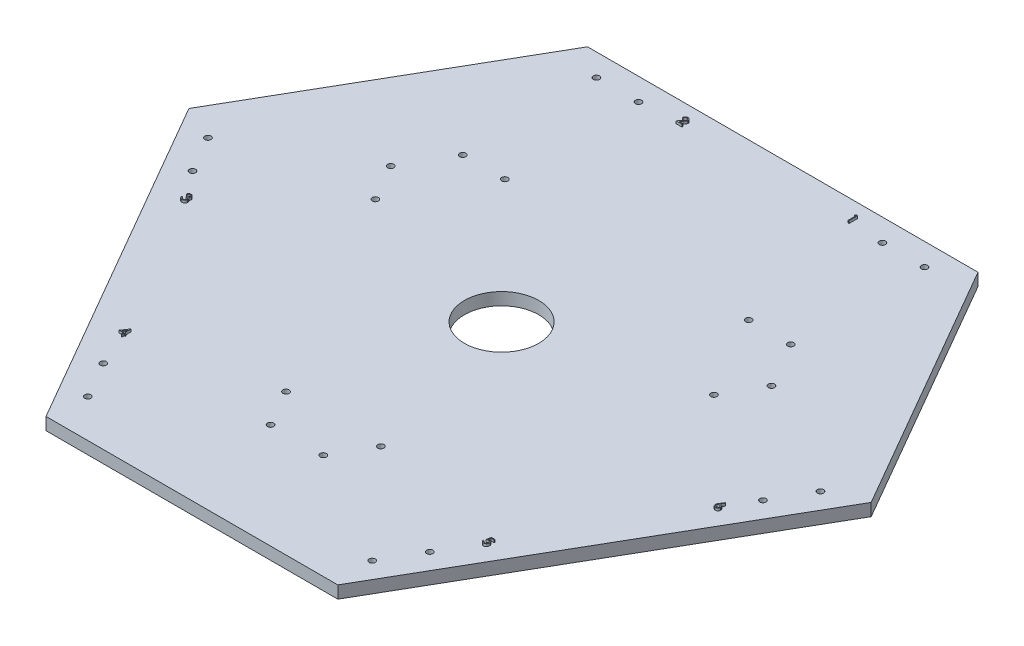
from build123d import *

# Parameters (mm, degrees)
SKETCH1_R           = 1.25
SKETCH1_R_2         = 15
BOSS_EXTRUDE1_DEPTH = 5
BOSS_EXTRUDE2_DEPTH = 1


with BuildPart() as part:
    # Sketch1 → Boss-Extrude1 (new body)
    with BuildSketch(Plane(origin=(0, 0, 0), x_dir=(1, 0, 0), z_dir=(0, 1, 0))):
        Polygon((-78.804643176, 113.506354147), (78.804643176, 113.506354147), (137.70170777, 11.493645853), (58.897064595, -125), (-58.897064595, -125), (-137.70170777, 11.493645853), align=None)
        with Locations(Location((-66.218576654, 104.506354147, 0), (0, 0, 270))):
            Circle(SKETCH1_R, mode=Mode.SUBTRACT)
        with Locations(Location((-49.218576654, 104.506354147, 0), (0, 0, 270))):
            Circle(SKETCH1_R, mode=Mode.SUBTRACT)
        with Locations(Location((-49.218576654, 50.506354147, 0), (0, 0, 270))):
            Circle(SKETCH1_R, mode=Mode.SUBTRACT)
        with Locations(Location((-66.218576654, 50.506354147, 0), (0, 0, 270))):
            Circle(SKETCH1_R, mode=Mode.SUBTRACT)
        with Locations(Location((66.218576654, 50.506354147, 0), (0, 0, 90))):
            Circle(SKETCH1_R, mode=Mode.SUBTRACT)
        with Locations(Location((49.218576654, 50.506354147, 0), (0, 0, 90))):
            Circle(SKETCH1_R, mode=Mode.SUBTRACT)
        with Locations(Location((49.218576654, 104.506354147, 0), (0, 0, 90))):
            Circle(SKETCH1_R, mode=Mode.SUBTRACT)
        with Locations(Location((66.218576654, 104.506354147, 0), (0, 0, 90))):
            Circle(SKETCH1_R, mode=Mode.SUBTRACT)
        with Locations(Location((123.614445876, 5.093792512, 0), (0, 0, 270))):
            Circle(SKETCH1_R, mode=Mode.SUBTRACT)
        with Locations(Location((115.114445876, -9.628639353, 0), (0, 0, 270))):
            Circle(SKETCH1_R, mode=Mode.SUBTRACT)
        with Locations(Location((68.349074071, 17.371360647, 0), (0, 0, 270))):
            Circle(SKETCH1_R, mode=Mode.SUBTRACT)
        with Locations(Location((76.849074071, 32.093792512, 0), (0, 0, 270))):
            Circle(SKETCH1_R, mode=Mode.SUBTRACT)
        with Locations(Location((10.630497417, -82.600146659, 0), (0, 0, 90))):
            Circle(SKETCH1_R, mode=Mode.SUBTRACT)
        with Locations(Location((19.130497417, -67.877714794, 0), (0, 0, 90))):
            Circle(SKETCH1_R, mode=Mode.SUBTRACT)
        with Locations(Location((65.895869221, -94.877714794, 0), (0, 0, 90))):
            Circle(SKETCH1_R, mode=Mode.SUBTRACT)
        with Locations(Location((57.395869221, -109.600146659, 0), (0, 0, 90))):
            Circle(SKETCH1_R, mode=Mode.SUBTRACT)
        with Locations(Location((-57.395869221, -109.600146659, 0), (0, 0, 270))):
            Circle(SKETCH1_R, mode=Mode.SUBTRACT)
        with Locations(Location((-65.895869221, -94.877714794, 0), (0, 0, 270))):
            Circle(SKETCH1_R, mode=Mode.SUBTRACT)
        with Locations(Location((-19.130497417, -67.877714794, 0), (0, 0, 270))):
            Circle(SKETCH1_R, mode=Mode.SUBTRACT)
        with Locations(Location((-10.630497417, -82.600146659, 0), (0, 0, 270))):
            Circle(SKETCH1_R, mode=Mode.SUBTRACT)
        with Locations(Location((-76.849074071, 32.093792512, 0), (0, 0, 90))):
            Circle(SKETCH1_R, mode=Mode.SUBTRACT)
        with Locations(Location((-68.349074071, 17.371360647, 0), (0, 0, 90))):
            Circle(SKETCH1_R, mode=Mode.SUBTRACT)
        with Locations(Location((-115.114445876, -9.628639353, 0), (0, 0, 90))):
            Circle(SKETCH1_R, mode=Mode.SUBTRACT)
        with Locations(Location((-123.614445876, 5.093792512, 0), (0, 0, 90))):
            Circle(SKETCH1_R, mode=Mode.SUBTRACT)
        with Locations(Location((0, 0, 0), (0, 0, 270))):
            Circle(SKETCH1_R_2, mode=Mode.SUBTRACT)
    extrude(amount=BOSS_EXTRUDE1_DEPTH)

    # Sketch2 → Boss-Extrude2 (add)
    # profile 1 of 6: a face of its own
    with BuildSketch(Plane(origin=(0, 5, 0), x_dir=(1, 0, 0), z_dir=(0, 1, 0))):
        Polygon((35.097082263, 108.006354147), (35.74421768, 108.006354147), (35.74421768, 104.506354147), (35.430115116, 104.506354147), (35.430115116, 107.647379788), (34.891653577, 107.647379788), align=None)
    # profile 2 of 6: a face of its own
    with BuildSketch(Plane(origin=(0, 5, 0), x_dir=(1, 0, 0), z_dir=(0, 1, 0))):
        with BuildLine():
            Line((-33.635243321, 106.92943107), (-33.949345885, 106.92943107))
            add(Edge.make_bspline(
                [(-33.949345885, 106.92943107), (-33.947298732, 106.971101958), (-33.943278178, 107.052942473), (-33.924449889, 107.172266379), (-33.897509012, 107.286321178), (-33.859417558, 107.394191092), (-33.81211128, 107.496829899), (-33.755381252, 107.593829915), (-33.688187402, 107.684821103), (-33.611980668, 107.768959947), (-33.529212029, 107.846147518), (-33.439906089, 107.91280276), (-33.346061062, 107.969120432), (-33.247961663, 108.016201674), (-33.1445011, 108.051541519), (-33.036618242, 108.077763159), (-32.923839105, 108.093539505), (-32.846999083, 108.09523529), (-32.807919603, 108.096097737)],
                knots=[0, 0, 0, 0, 1.10065271, 2.161652631, 3.183658789, 4.190468796, 5.17591951, 6.163126047, 7.15150782, 8.156236427, 9.156009102, 10.134482811, 11.092018607, 12.041330605, 13.001268258, 13.972401359, 14.968799086, 16, 16, 16, 16], degree=3))
            add(Edge.make_bspline(
                [(-32.807919603, 108.096097737), (-32.769541529, 108.095199281), (-32.694129984, 108.093433846), (-32.58406797, 108.078272816), (-32.479290675, 108.054527225), (-32.380002909, 108.021211809), (-32.286996844, 107.976427381), (-32.1995738, 107.922629842), (-32.116692989, 107.860410011), (-32.042086205, 107.787156198), (-31.973578126, 107.708953813), (-31.914475871, 107.62546591), (-31.863862708, 107.539236624), (-31.821675028, 107.449608422), (-31.790618889, 107.355737394), (-31.767040681, 107.258990191), (-31.753713267, 107.15836538), (-31.751667843, 107.090258824), (-31.750627936, 107.055632993)],
                knots=[0, 0, 0, 0, 1.111607364, 2.184268762, 3.212621178, 4.221274766, 5.211760367, 6.196651075, 7.1921475, 8.207485113, 9.220403448, 10.201281604, 11.166441695, 12.114753415, 13.065576456, 14.026450734, 14.996634279, 16, 16, 16, 16], degree=3))
            add(Edge.make_bspline(
                [(-31.750627936, 107.055632993), (-31.752321199, 107.006885159), (-31.755678011, 106.910244945), (-31.784392387, 106.768230082), (-31.829238898, 106.630636663), (-31.883236255, 106.519899361), (-31.937708699, 106.430665868), (-31.986796207, 106.357197163), (-32.044261018, 106.278091694), (-32.110939516, 106.193614357), (-32.185452388, 106.103103452), (-32.268474551, 106.006613656), (-32.360598033, 105.905141887), (-32.425256534, 105.835836285), (-32.458760949, 105.799923859)],
                knots=[0, 0, 0, 0, 1.184426356, 2.348067706, 3.509069118, 4.696110526, 5.333549288, 6.050745305, 6.844228056, 7.710549037, 8.667450064, 9.695053472, 10.805634456, 12, 12, 12, 12], degree=3))
            Line((-32.458760949, 105.799923859), (-33.334462071, 104.865328506))
            Line((-33.334462071, 104.865328506), (-31.705756142, 104.865328506))
            Line((-31.705756142, 104.865328506), (-31.705756142, 104.506354147))
            Line((-31.705756142, 104.506354147), (-34.08396127, 104.506354147))
            Line((-34.08396127, 104.506354147), (-32.726589475, 105.954871775))
            add(Edge.make_bspline(
                [(-32.726589475, 105.954871775), (-32.693541588, 105.989370082), (-32.630063361, 106.055634269), (-32.540280784, 106.152377229), (-32.459641796, 106.24212677), (-32.387624403, 106.324713318), (-32.325790898, 106.401344886), (-32.270918666, 106.469539589), (-32.226953075, 106.53229404), (-32.179237679, 106.605034654), (-32.133023698, 106.693846971), (-32.093311342, 106.80238066), (-32.069096493, 106.914107913), (-32.066191658, 106.98960995), (-32.064730501, 107.027588122)],
                knots=[0, 0, 0, 0, 1.329631726, 2.553950428, 3.673215718, 4.687767853, 5.603093632, 6.413772471, 7.123043292, 7.734684054, 8.834405432, 9.900288307, 10.943827018, 12, 12, 12, 12], degree=3))
            add(Edge.make_bspline(
                [(-32.064730501, 107.027588122), (-32.065366243, 107.05146952), (-32.066619169, 107.09853517), (-32.077676866, 107.167540929), (-32.094387372, 107.234105743), (-32.11833263, 107.298434362), (-32.149939371, 107.359880014), (-32.18841275, 107.418517495), (-32.232802814, 107.47520646), (-32.284154083, 107.528359758), (-32.340565603, 107.577040963), (-32.400159853, 107.620165049), (-32.463209957, 107.65620416), (-32.529450079, 107.685747657), (-32.598695548, 107.708923038), (-32.671080294, 107.724981617), (-32.74640431, 107.735064101), (-32.797837806, 107.736428273), (-32.824045404, 107.737123378)],
                knots=[0, 0, 0, 0, 0.991446411, 1.95395049, 2.89581595, 3.838931463, 4.798493298, 5.75982156, 6.748411868, 7.785213223, 8.824556874, 9.840280684, 10.836137867, 11.835679398, 12.848801643, 13.863922112, 14.911575587, 16, 16, 16, 16], degree=3))
            add(Edge.make_bspline(
                [(-32.824045404, 107.737123378), (-32.851416237, 107.736408346), (-32.905168033, 107.73500414), (-32.984087066, 107.725181476), (-33.059372844, 107.708235636), (-33.131214747, 107.685058962), (-33.199734333, 107.655600413), (-33.264598377, 107.618908668), (-33.325661266, 107.575125175), (-33.383037789, 107.525484619), (-33.435901768, 107.470217018), (-33.482348644, 107.408607054), (-33.522932658, 107.341779639), (-33.558341892, 107.269915089), (-33.587097582, 107.192361309), (-33.609070732, 107.109393604), (-33.626457579, 107.021372222), (-33.6322661, 106.960587137), (-33.635243321, 106.92943107)],
                knots=[0, 0, 0, 0, 1.031018746, 2.02475058, 2.990194455, 3.934040569, 4.864654155, 5.795059489, 6.735614925, 7.690564532, 8.649604399, 9.611025574, 10.590972636, 11.591080095, 12.624614302, 13.701020113, 14.821632451, 16, 16, 16, 16], degree=3))
        make_face()
    # profile 3 of 6: a face of its own
    with BuildSketch(Plane(origin=(0, 5, 0), x_dir=(1, 0, 0), z_dir=(0, 1, 0))):
        with BuildLine():
            Line((-107.031112542, -19.926712717), (-107.345215106, -19.926712717))
            add(Edge.make_bspline(
                [(-107.345215106, -19.926712717), (-107.336705556, -19.891480233), (-107.32007008, -19.822603609), (-107.285372507, -19.724196348), (-107.247573251, -19.631072827), (-107.202184147, -19.544976753), (-107.152675393, -19.46417785), (-107.095952671, -19.390508726), (-107.034632949, -19.32209576), (-106.966807999, -19.261382523), (-106.895679338, -19.206404794), (-106.820244718, -19.159529736), (-106.742021824, -19.119205583), (-106.660468691, -19.085985351), (-106.57534252, -19.060959828), (-106.487412896, -19.042803022), (-106.396449396, -19.031011908), (-106.334701806, -19.029861145), (-106.303348119, -19.02927682)],
                knots=[0, 0, 0, 0, 1.162005537, 2.271625781, 3.343758855, 4.383309926, 5.390229558, 6.379919256, 7.361854164, 8.333198761, 9.295911338, 10.242430842, 11.177959212, 12.116337295, 13.062827104, 14.020064771, 14.994644689, 16, 16, 16, 16], degree=3))
            add(Edge.make_bspline(
                [(-106.303348119, -19.02927682), (-106.257665377, -19.03065605), (-106.167296366, -19.033384426), (-106.034533319, -19.058298862), (-105.9065065, -19.097723994), (-105.784617252, -19.152197722), (-105.67139882, -19.219385035), (-105.570662633, -19.299349772), (-105.483774122, -19.390549073), (-105.410879745, -19.491281637), (-105.353804745, -19.598937147), (-105.311718372, -19.709737304), (-105.286096691, -19.823419275), (-105.282776134, -19.900176555), (-105.281112542, -19.938631788)],
                knots=[0, 0, 0, 0, 1.083050992, 2.142477498, 3.193116406, 4.255571735, 5.30263384, 6.308962982, 7.297363603, 8.282367274, 9.249857812, 10.179914175, 11.08814088, 12, 12, 12, 12], degree=3))
            add(Edge.make_bspline(
                [(-105.281112542, -19.938631788), (-105.282276133, -19.975638583), (-105.2845531, -20.048055137), (-105.303886806, -20.153776634), (-105.336423069, -20.253418234), (-105.381492831, -20.347399397), (-105.439834382, -20.435124236), (-105.510507079, -20.516790127), (-105.59400974, -20.592759285), (-105.657288678, -20.636278758), (-105.689866549, -20.658683871)],
                knots=[0, 0, 0, 0, 1.024540389, 2.004866551, 2.965041327, 3.920577974, 4.882998113, 5.874504559, 6.905732034, 8, 8, 8, 8], degree=3))
            add(Edge.make_bspline(
                [(-105.689866549, -20.658683871), (-105.652634794, -20.676662043), (-105.57886792, -20.712282), (-105.47831739, -20.782137758), (-105.387039515, -20.862794105), (-105.336135796, -20.925736758), (-105.310559658, -20.957361756)],
                knots=[0, 0, 0, 0, 1.015518401, 2.012035669, 3.001164323, 4, 4, 4, 4], degree=3))
            add(Edge.make_bspline(
                [(-105.310559658, -20.957361756), (-105.293718315, -20.980419507), (-105.260311419, -21.026157424), (-105.219075886, -21.09969385), (-105.181666771, -21.174045339), (-105.152516552, -21.251204745), (-105.129942685, -21.330277759), (-105.113806653, -21.411400155), (-105.103782512, -21.494638177), (-105.10234696, -21.550950658), (-105.101625363, -21.579256788)],
                knots=[0, 0, 0, 0, 1.025084078, 2.033381695, 3.024893161, 4.013698104, 4.991890475, 5.976764909, 6.982997093, 8, 8, 8, 8], degree=3))
            add(Edge.make_bspline(
                [(-105.101625363, -21.579256788), (-105.103419876, -21.628266509), (-105.107000458, -21.726055311), (-105.139004533, -21.870530032), (-105.188617773, -22.011755535), (-105.259074709, -22.146830374), (-105.344942218, -22.273210755), (-105.447099542, -22.386287064), (-105.564385951, -22.483485668), (-105.6951916, -22.564695896), (-105.836908728, -22.629613819), (-105.98848432, -22.674671261), (-106.147734374, -22.704017261), (-106.256941672, -22.70716413), (-106.312462703, -22.708763999)],
                knots=[0, 0, 0, 0, 0.955779014, 1.907060117, 2.875433937, 3.871313158, 4.872415639, 5.851225146, 6.836215519, 7.83643374, 8.849228613, 9.86973379, 10.916971861, 12, 12, 12, 12], degree=3))
            add(Edge.make_bspline(
                [(-106.312462703, -22.708763999), (-106.349882003, -22.707895786), (-106.423510708, -22.706187432), (-106.531754206, -22.694508831), (-106.635075906, -22.673178825), (-106.733615504, -22.64447552), (-106.82746054, -22.608083778), (-106.916324645, -22.56276508), (-107.000754539, -22.509453578), (-107.07995349, -22.44751999), (-107.153912057, -22.37823865), (-107.220664782, -22.30037964), (-107.281324575, -22.215382237), (-107.334267213, -22.12225918), (-107.381904166, -22.022213923), (-107.421085123, -21.913965425), (-107.455570691, -21.798481403), (-107.471604155, -21.718003662), (-107.479830491, -21.676712717)],
                knots=[0, 0, 0, 0, 1.048658725, 2.063410685, 3.046034179, 4.001477787, 4.936774919, 5.862367409, 6.792675028, 7.730719943, 8.675894397, 9.627829632, 10.600096036, 11.597688215, 12.626045268, 13.701542398, 14.82072376, 16, 16, 16, 16], degree=3))
            Line((-107.479830491, -21.676712717), (-107.165727927, -21.676712717))
            add(Edge.make_bspline(
                [(-107.165727927, -21.676712717), (-107.157544635, -21.703661731), (-107.141627423, -21.756079902), (-107.114533125, -21.831520208), (-107.083664853, -21.900678261), (-107.050550294, -21.964061383), (-107.015771848, -22.022293786), (-106.976856923, -22.073835655), (-106.936687778, -22.120950857), (-106.906408424, -22.147495469), (-106.891589305, -22.160486756)],
                knots=[0, 0, 0, 0, 1.198163088, 2.33053128, 3.407730985, 4.417276592, 5.372219308, 6.28897303, 7.162600585, 8, 8, 8, 8], degree=3))
            add(Edge.make_bspline(
                [(-106.891589305, -22.160486756), (-106.871992729, -22.17559509), (-106.832860066, -22.205765121), (-106.769091835, -22.24426675), (-106.702026949, -22.277627775), (-106.630212274, -22.303111471), (-106.555197504, -22.324689132), (-106.475770139, -22.338809651), (-106.392630922, -22.348497822), (-106.335863158, -22.349352754), (-106.306853728, -22.34978964)],
                knots=[0, 0, 0, 0, 0.946170439, 1.889420265, 2.845303464, 3.807233317, 4.801018734, 5.828864929, 6.890507805, 8, 8, 8, 8], degree=3))
            add(Edge.make_bspline(
                [(-106.306853728, -22.34978964), (-106.274100226, -22.349173735), (-106.210053579, -22.347969386), (-106.116598719, -22.336893679), (-106.027691272, -22.320763265), (-105.944318346, -22.295850282), (-105.865387839, -22.265069431), (-105.792006189, -22.226421026), (-105.723210083, -22.181076304), (-105.659880677, -22.129537145), (-105.60293517, -22.07311565), (-105.552795657, -22.014102579), (-105.510170995, -21.95274675), (-105.475787417, -21.888708629), (-105.448636867, -21.8222534), (-105.430153666, -21.75319457), (-105.417302151, -21.682097304), (-105.416255539, -21.633768335), (-105.415727927, -21.609405025)],
                knots=[0, 0, 0, 0, 1.217147791, 2.380027433, 3.494444702, 4.572153297, 5.609568379, 6.639424714, 7.649109417, 8.668170816, 9.669597737, 10.625200337, 11.543417969, 12.441394052, 13.322311151, 14.205496177, 15.095365482, 16, 16, 16, 16], degree=3))
            add(Edge.make_bspline(
                [(-105.415727927, -21.609405025), (-105.417258228, -21.576793686), (-105.420311217, -21.511733278), (-105.443619796, -21.416015704), (-105.481958661, -21.323792291), (-105.535631172, -21.236636501), (-105.600966901, -21.1558606), (-105.677331807, -21.083789117), (-105.765360036, -21.024319026), (-105.846379905, -20.98323037), (-105.918145061, -20.955193294), (-105.979560446, -20.93651833), (-106.048317049, -20.920704674), (-106.123583398, -20.905992403), (-106.205926614, -20.893471055), (-106.295257052, -20.883029239), (-106.391592814, -20.874674198), (-106.45828398, -20.870943103), (-106.492651004, -20.86902041)],
                knots=[0, 0, 0, 0, 1.07054697, 2.135767047, 3.216561865, 4.33974944, 5.486079747, 6.621378074, 7.775625952, 8.963672916, 9.598146892, 10.304877434, 11.070270905, 11.915000392, 12.823868403, 13.805723172, 14.86925407, 16, 16, 16, 16], degree=3))
            Line((-106.492651004, -20.86902041), (-106.492651004, -20.510046051))
            add(Edge.make_bspline(
                [(-106.492651004, -20.510046051), (-106.449349838, -20.509311247), (-106.364533492, -20.507871947), (-106.240639187, -20.490463937), (-106.122165875, -20.466383308), (-106.011739133, -20.429498116), (-105.911090419, -20.386657819), (-105.823770817, -20.33680561), (-105.75100367, -20.281390861), (-105.693142598, -20.219558251), (-105.64961337, -20.153243204), (-105.617786572, -20.084126546), (-105.598986246, -20.011602485), (-105.596476579, -19.962107817), (-105.595215106, -19.937229544)],
                knots=[0, 0, 0, 0, 1.321986639, 2.589447074, 3.816329219, 5.01088745, 6.139805852, 7.153945165, 8.075214402, 8.924034688, 9.728124013, 10.488707548, 11.240355623, 12, 12, 12, 12], degree=3))
            add(Edge.make_bspline(
                [(-105.595215106, -19.937229544), (-105.595629517, -19.918951799), (-105.596453968, -19.882589092), (-105.606851246, -19.829464023), (-105.622475287, -19.777963077), (-105.643955016, -19.728305267), (-105.672705215, -19.680834993), (-105.707111202, -19.635147544), (-105.748079302, -19.591503765), (-105.795024749, -19.550823446), (-105.845436554, -19.512054209), (-105.900686329, -19.479140572), (-105.959108204, -19.450995509), (-106.020766858, -19.427786007), (-106.085862389, -19.410326719), (-106.154088946, -19.397790878), (-106.22557663, -19.389953223), (-106.274348362, -19.388824807), (-106.299141388, -19.388251179)],
                knots=[0, 0, 0, 0, 0.884392785, 1.759457502, 2.611959086, 3.489218968, 4.37281399, 5.2945488, 6.255912374, 7.266815255, 8.301784654, 9.332968512, 10.37626691, 11.440494194, 12.520033166, 13.637162961, 14.798855837, 16, 16, 16, 16], degree=3))
            add(Edge.make_bspline(
                [(-106.299141388, -19.388251179), (-106.338993056, -19.389642541), (-106.416832633, -19.392360194), (-106.52904755, -19.416163208), (-106.633366884, -19.454141291), (-106.71310555, -19.499474311), (-106.771988124, -19.544224745), (-106.814065063, -19.583307131), (-106.855385573, -19.626739955), (-106.89323125, -19.67719833), (-106.931505227, -19.73126512), (-106.966349788, -19.791688802), (-107.00020948, -19.856893196), (-107.02061203, -19.902988831), (-107.031112542, -19.926712717)],
                knots=[0, 0, 0, 0, 1.472543308, 2.876219568, 4.221790263, 5.565193594, 6.249813518, 6.953379497, 7.687249741, 8.463570142, 9.283606569, 10.136032583, 11.040678096, 12, 12, 12, 12], degree=3))
        make_face()
    # profile 4 of 6: a face of its own
    with BuildSketch(Plane(origin=(0, 5, 0), x_dir=(1, 0, 0), z_dir=(0, 1, 0))):
        Polygon((-71.350696946, -78.297590148), (-71.286894862, -78.297590148), (-71.286894862, -80.720667071), (-70.883048708, -80.720667071), (-70.883048708, -81.07964143), (-71.286894862, -81.07964143), (-71.286894862, -81.887333738), (-71.600997426, -81.887333738), (-71.600997426, -81.07964143), (-73.261253837, -81.07964143), align=None)
        Polygon((-71.600997426, -80.720667071), (-71.600997426, -79.20063502), (-72.644266657, -80.720667071), align=None, mode=Mode.SUBTRACT)
    # profile 5 of 6: a face of its own
    with BuildSketch(Plane(origin=(0, 5, 0), x_dir=(1, 0, 0), z_dir=(0, 1, 0))):
        with BuildLine():
            Line((75.729202555, -78.387333738), (75.729202555, -78.746308097))
            Line((75.729202555, -78.746308097), (74.538697747, -78.746308097))
            Line((74.538697747, -78.746308097), (74.350095984, -79.666881013))
            add(Edge.make_bspline(
                [(74.350095984, -79.666881013), (74.387151858, -79.656650742), (74.458941754, -79.636831208), (74.564901615, -79.614825437), (74.665493819, -79.601559993), (74.730769189, -79.599748683), (74.762355599, -79.598872199)],
                knots=[0, 0, 0, 0, 1.100273476, 2.13160584, 3.095893838, 4, 4, 4, 4], degree=3))
            add(Edge.make_bspline(
                [(74.762355599, -79.598872199), (74.801439339, -79.599718135), (74.878287736, -79.601381456), (74.990726683, -79.617353305), (75.098059577, -79.64249322), (75.200061947, -79.677613742), (75.296922498, -79.722523475), (75.387750059, -79.778623415), (75.473907972, -79.844156746), (75.553850566, -79.919501758), (75.626374874, -80.002423375), (75.690140864, -80.091581246), (75.744303454, -80.186108908), (75.787864209, -80.286909517), (75.822648543, -80.39286867), (75.845800538, -80.505101253), (75.861217247, -80.622549373), (75.862939633, -80.702853943), (75.863817939, -80.74380409)],
                knots=[0, 0, 0, 0, 1.052922333, 2.070308379, 3.05430497, 4.020497103, 4.973039431, 5.925935799, 6.892292201, 7.88610001, 8.88166317, 9.857072816, 10.836096531, 11.812156883, 12.81219415, 13.836441305, 14.89672472, 16, 16, 16, 16], degree=3))
            add(Edge.make_bspline(
                [(75.863817939, -80.74380409), (75.863152864, -80.772326311), (75.861831701, -80.828985298), (75.855113114, -80.913129499), (75.842177398, -80.995492332), (75.824809673, -81.076084724), (75.802267256, -81.154754096), (75.774978202, -81.231725624), (75.741582174, -81.306520231), (75.704950799, -81.379845626), (75.663704321, -81.450044133), (75.617925813, -81.515693119), (75.569560322, -81.577777401), (75.517518937, -81.635631134), (75.461317942, -81.688874152), (75.401637975, -81.737822433), (75.338955256, -81.783303764), (75.272300013, -81.823471959), (75.20315753, -81.860434915), (75.130529313, -81.890758452), (75.056068613, -81.91786898), (74.978703737, -81.939478508), (74.898609925, -81.956411062), (74.815655149, -81.967911663), (74.730274479, -81.976288101), (74.672399467, -81.976812457), (74.643164894, -81.977077327)],
                knots=[0, 0, 0, 0, 1.056347294, 2.098418968, 3.122841568, 4.141288669, 5.149314143, 6.15115421, 7.162517403, 8.180376062, 9.185164535, 10.17417709, 11.141909838, 12.097768115, 13.052685741, 14.0056014, 14.954263652, 15.917497458, 16.885230207, 17.854509472, 18.828990115, 19.81800267, 20.826176721, 21.857883937, 22.917946725, 24, 24, 24, 24], degree=3))
            add(Edge.make_bspline(
                [(74.643164894, -81.977077327), (74.608290714, -81.976386489), (74.539679883, -81.975027347), (74.439159316, -81.960808862), (74.34244471, -81.940444946), (74.250314609, -81.909808676), (74.161943345, -81.871421381), (74.078520628, -81.82290521), (73.997914851, -81.767926106), (73.923402815, -81.703045753), (73.854246701, -81.632130071), (73.792340192, -81.55517243), (73.737206616, -81.473442988), (73.689728869, -81.386544834), (73.649230847, -81.294706303), (73.617415859, -81.197583302), (73.591737504, -81.095683298), (73.580874084, -81.025529787), (73.575356401, -80.98989784)],
                knots=[0, 0, 0, 0, 1.0467383, 2.05933395, 3.04377827, 4.011590433, 4.970194871, 5.932262533, 6.905835911, 7.896367577, 8.894135286, 9.877477877, 10.858688626, 11.851381753, 12.8477658, 13.868841284, 14.917554742, 16, 16, 16, 16], degree=3))
            Line((73.575356401, -80.98989784), (73.889458965, -80.98989784))
            add(Edge.make_bspline(
                [(73.889458965, -80.98989784), (73.897187522, -81.023274293), (73.912042239, -81.087425688), (73.944647987, -81.177557029), (73.984513863, -81.257876253), (74.031918211, -81.329445836), (74.088468242, -81.391854833), (74.152997671, -81.447471895), (74.225345394, -81.497647024), (74.305738623, -81.539469792), (74.390551703, -81.575138545), (74.479318913, -81.59889024), (74.569623259, -81.615591133), (74.630701629, -81.617262894), (74.661394061, -81.618102968)],
                knots=[0, 0, 0, 0, 1.136247022, 2.183929868, 3.172523383, 4.106158343, 5.02341133, 5.958108904, 6.928429099, 7.938127109, 8.96079061, 9.975095812, 10.982467395, 12, 12, 12, 12], degree=3))
            add(Edge.make_bspline(
                [(74.661394061, -81.618102968), (74.691352505, -81.617282191), (74.750340928, -81.615666072), (74.837152314, -81.60322706), (74.920965188, -81.584069489), (75.000952545, -81.555399634), (75.078514085, -81.520554915), (75.151687855, -81.47583984), (75.222590732, -81.424379821), (75.289018866, -81.365423191), (75.349858315, -81.300453496), (75.403614436, -81.230976103), (75.44839135, -81.156859256), (75.486125459, -81.079386104), (75.514778757, -80.997707546), (75.535219739, -80.912206371), (75.547222797, -80.822671391), (75.548873977, -80.761602081), (75.549715375, -80.730482776)],
                knots=[0, 0, 0, 0, 1.027316725, 2.022795036, 3.002884548, 3.971462791, 4.93288096, 5.914575861, 6.907176829, 7.935150275, 8.956128384, 9.956726525, 10.942570165, 11.921478529, 12.907843606, 13.90538589, 14.932640048, 16, 16, 16, 16], degree=3))
            add(Edge.make_bspline(
                [(75.549715375, -80.730482776), (75.549056896, -80.702407025), (75.547768016, -80.647452735), (75.537237445, -80.567053529), (75.518920473, -80.490980487), (75.493496593, -80.418866253), (75.461217085, -80.35064281), (75.421770773, -80.28623975), (75.374417375, -80.226505917), (75.320325487, -80.171413363), (75.261067446, -80.120568488), (75.195623703, -80.077224402), (75.125363776, -80.040760484), (75.051134177, -80.009292486), (74.971169278, -79.986691741), (74.887052646, -79.969723855), (74.797875938, -79.959908493), (74.73690525, -79.958546604), (74.705564734, -79.957846558)],
                knots=[0, 0, 0, 0, 1.045622112, 2.046656509, 3.013763289, 3.955457236, 4.890082067, 5.820317437, 6.762574623, 7.722996705, 8.69280354, 9.665887285, 10.63943826, 11.638615906, 12.663482002, 13.728887084, 14.832589034, 16, 16, 16, 16], degree=3))
            add(Edge.make_bspline(
                [(74.705564734, -79.957846558), (74.678435805, -79.958427149), (74.62242145, -79.959625923), (74.536498623, -79.96845242), (74.4462069, -79.982691714), (74.351892405, -80.002277962), (74.253271897, -80.027909038), (74.150553496, -80.058623539), (74.043521229, -80.095345538), (73.971403505, -80.123077751), (73.93433076, -80.137333738)],
                knots=[0, 0, 0, 0, 0.817624296, 1.688186739, 2.600797293, 3.572016777, 4.590301741, 5.671205678, 6.80286297, 8, 8, 8, 8], degree=3))
            Line((73.93433076, -80.137333738), (74.293305119, -78.387333738))
            Line((74.293305119, -78.387333738), (75.729202555, -78.387333738))
        make_face()
    # profile 6 of 6: a face of its own
    with BuildSketch(Plane(origin=(0, 5, 0), x_dir=(1, 0, 0), z_dir=(0, 1, 0))):
        with BuildLine():
            Line((109.364445876, -19.02927682), (109.606332895, -19.219280826))
            Line((109.606332895, -19.219280826), (108.681553247, -20.633443487))
            add(Edge.make_bspline(
                [(108.681553247, -20.633443487), (108.743123524, -20.623629626), (108.863223311, -20.604486581), (108.98478921, -20.601328636), (109.044033215, -20.59978964)],
                knots=[0, 0, 0, 0, 1.025318673, 2, 2, 2, 2], degree=3))
            add(Edge.make_bspline(
                [(109.044033215, -20.59978964), (109.079605712, -20.600745752), (109.149629112, -20.602627829), (109.252435914, -20.61711168), (109.35122485, -20.639936792), (109.445586463, -20.673209048), (109.535859444, -20.715711402), (109.622561841, -20.766650273), (109.704063851, -20.828655953), (109.78141503, -20.897920909), (109.851642127, -20.974637893), (109.913818183, -21.05603923), (109.966044975, -21.142040111), (110.008418896, -21.232596977), (110.041323775, -21.327570237), (110.06531142, -21.426838376), (110.079491013, -21.530469847), (110.081416503, -21.600948023), (110.082394594, -21.636748775)],
                knots=[0, 0, 0, 0, 1.04369286, 2.054478336, 3.041073146, 4.015093852, 4.984733326, 5.965804835, 6.960378782, 7.985147595, 9.009457201, 10.008161701, 10.986880575, 11.956520048, 12.937015923, 13.931873656, 14.949455224, 16, 16, 16, 16], degree=3))
            add(Edge.make_bspline(
                [(110.082394594, -21.636748775), (110.080971489, -21.685728479), (110.078171155, -21.782108945), (110.050267359, -21.922485651), (110.006907714, -22.056218167), (109.944930186, -22.181171338), (109.867947803, -22.297173908), (109.77407021, -22.399959373), (109.666626722, -22.491629411), (109.545139924, -22.56828603), (109.41439696, -22.630889081), (109.277044962, -22.675854323), (109.134417816, -22.703537792), (109.037613208, -22.707008395), (108.988644594, -22.708763999)],
                knots=[0, 0, 0, 0, 1.031375318, 2.029502543, 3.004789286, 3.987476834, 4.960371455, 5.9300674, 6.912260825, 7.929083631, 8.949397511, 9.960523116, 10.96833055, 12, 12, 12, 12], degree=3))
            add(Edge.make_bspline(
                [(108.988644594, -22.708763999), (108.941547893, -22.707235794), (108.848257575, -22.704208686), (108.711024781, -22.677242748), (108.579161763, -22.633535645), (108.453592382, -22.573321366), (108.337271769, -22.497263483), (108.233206133, -22.405701204), (108.141914359, -22.300591739), (108.065939738, -22.181951392), (108.005681006, -22.054461434), (107.960491081, -21.921524278), (107.934094837, -21.783624296), (107.93040628, -21.690143157), (107.92854844, -21.643058871)],
                knots=[0, 0, 0, 0, 1.012016664, 2.004627821, 2.994792927, 3.992885782, 4.990978636, 5.973936114, 6.964471063, 7.975201453, 8.993600317, 9.990122807, 10.98767138, 12, 12, 12, 12], degree=3))
            add(Edge.make_bspline(
                [(107.92854844, -21.643058871), (107.929729885, -21.607014288), (107.93214217, -21.533418136), (107.94898556, -21.421954108), (107.976050355, -21.307903026), (108.006360601, -21.211148833), (108.038386211, -21.131887311), (108.065038751, -21.06798382), (108.098212747, -21.002222747), (108.133586128, -20.932349111), (108.174342997, -20.860163678), (108.218658646, -20.784460009), (108.267758297, -20.706442081), (108.30217846, -20.653497886), (108.319774401, -20.626432269)],
                knots=[0, 0, 0, 0, 1.173818275, 2.396712641, 3.66331629, 4.989737886, 5.693666774, 6.447286557, 7.243889047, 8.091586357, 8.998013824, 9.943181721, 10.948533338, 12, 12, 12, 12], degree=3))
            Line((108.319774401, -20.626432269), (109.364445876, -19.02927682))
        make_face()
        with BuildLine():
            add(Edge.make_bspline(
                [(108.978127767, -20.958763999), (108.951465522, -20.959542043), (108.899386412, -20.961061788), (108.822978998, -20.96988704), (108.750665746, -20.986506106), (108.681488613, -21.007672438), (108.61674091, -21.036775498), (108.55595207, -21.072127296), (108.498887018, -21.113748475), (108.446143466, -21.161049386), (108.398323803, -21.212837419), (108.357142672, -21.268306941), (108.321620272, -21.326121144), (108.292738453, -21.386763086), (108.270248377, -21.450209586), (108.253980126, -21.516168835), (108.244926375, -21.585083141), (108.243420144, -21.631815644), (108.242651004, -21.655679063)],
                knots=[0, 0, 0, 0, 1.129588631, 2.206414736, 3.251139165, 4.268635594, 5.265702196, 6.250456724, 7.242448911, 8.251968645, 9.246821453, 10.222880186, 11.173611482, 12.116736599, 13.062300278, 14.020270554, 14.989073742, 16, 16, 16, 16], degree=3))
            add(Edge.make_bspline(
                [(108.242651004, -21.655679063), (108.243277365, -21.679329043), (108.244505567, -21.725703133), (108.255657887, -21.794042313), (108.272692969, -21.859807221), (108.298033365, -21.92265882), (108.328260253, -21.983555138), (108.368165577, -22.040290423), (108.412382363, -22.096310493), (108.465236297, -22.147311965), (108.52195966, -22.194768589), (108.582560862, -22.236248843), (108.645720822, -22.271735016), (108.712292244, -22.299546114), (108.781330628, -22.3223704), (108.853411182, -22.33843188), (108.928584038, -22.347512406), (108.979505976, -22.349020599), (109.005471517, -22.34978964)],
                knots=[0, 0, 0, 0, 0.989467248, 1.94019797, 2.891935182, 3.827694429, 4.772920941, 5.730924762, 6.725747692, 7.756678648, 8.79901574, 9.819492441, 10.826891316, 11.826466727, 12.835195252, 13.867842842, 14.912794438, 16, 16, 16, 16], degree=3))
            add(Edge.make_bspline(
                [(109.005471517, -22.34978964), (109.031437015, -22.349020539), (109.08235887, -22.347512227), (109.15753233, -22.338432558), (109.229610649, -22.32236791), (109.298657157, -22.29955514), (109.365198588, -22.27170153), (109.42830331, -22.236469611), (109.488331403, -22.194513493), (109.545092003, -22.147393065), (109.597725941, -22.096020213), (109.64300322, -22.04079049), (109.681686453, -21.983096595), (109.71312064, -21.922898705), (109.738181932, -21.859769218), (109.755303399, -21.794052494), (109.766432688, -21.725700468), (109.767664054, -21.679328143), (109.768292029, -21.655679063)],
                knots=[0, 0, 0, 0, 1.087397944, 2.132534446, 3.165364764, 4.174271784, 5.174024072, 6.181601208, 7.194203697, 8.236725232, 9.267838612, 10.269026844, 11.221737037, 12.171628256, 13.107553087, 14.05945871, 15.010357665, 16, 16, 16, 16], degree=3))
            add(Edge.make_bspline(
                [(109.768292029, -21.655679063), (109.767741736, -21.631784513), (109.76666169, -21.58488728), (109.754445742, -21.516199662), (109.737503368, -21.449874456), (109.711920337, -21.386328507), (109.678683792, -21.325812579), (109.638200385, -21.268020978), (109.591367815, -21.212510631), (109.537270275, -21.160947823), (109.478380042, -21.113800745), (109.415764456, -21.072181188), (109.350256482, -21.037056212), (109.28192254, -21.007749109), (109.209979657, -20.986599635), (109.135589318, -20.969946392), (109.057800076, -20.961084374), (109.005023467, -20.959547309), (108.978127767, -20.958763999)],
                knots=[0, 0, 0, 0, 0.978206639, 1.919901502, 2.851605144, 3.780102724, 4.718870031, 5.675451981, 6.667674623, 7.690630536, 8.733308323, 9.756129687, 10.767539656, 11.776269907, 12.797430371, 13.836405707, 14.897401972, 16, 16, 16, 16], degree=3))
        make_face(mode=Mode.SUBTRACT)
    extrude(amount=BOSS_EXTRUDE2_DEPTH)


solid = part.part
